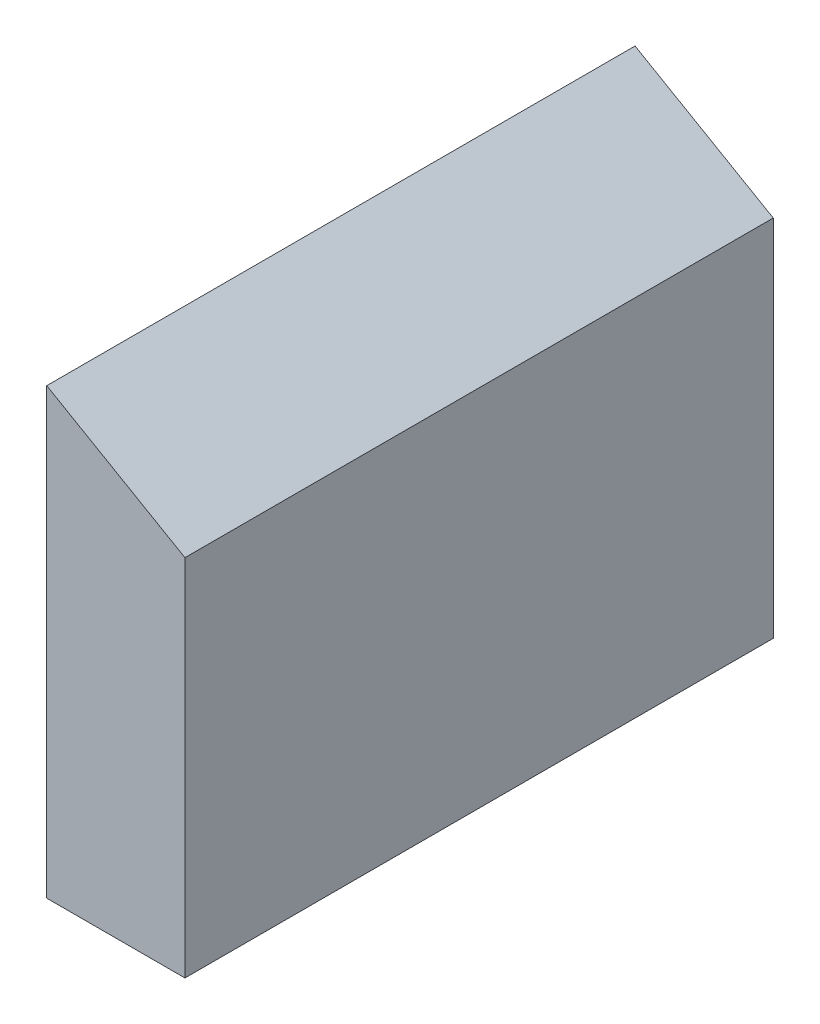
from build123d import *

# Parameters (mm, degrees)
BOSS_EXTRUDE1_DEPTH = 42.57


with BuildPart() as part:
    # Sketch1 → Boss-Extrude1 (new body)
    with BuildSketch(Plane.XY):
        Polygon((0, 0), (10, 0), (10, 26.34), (0, 32.118), align=None)
    extrude(amount=BOSS_EXTRUDE1_DEPTH)


solid = part.part
